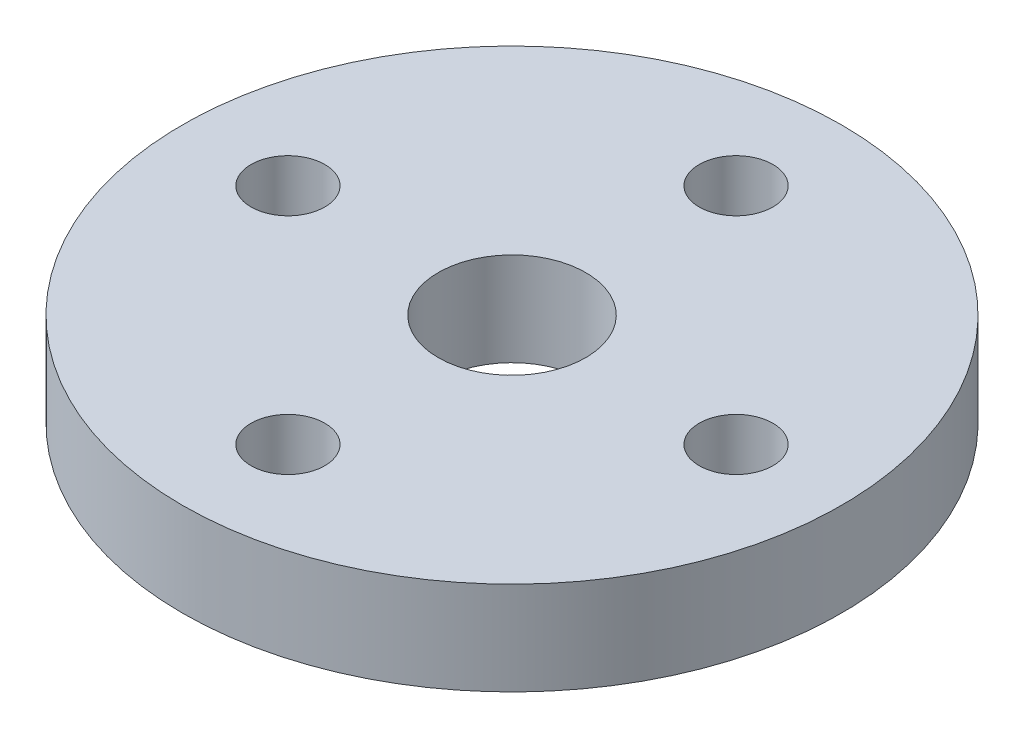
from build123d import *

# Parameters (mm, degrees)
SKETCH1_R           = 17.65
SKETCH1_R_2         = 3.95
SKETCH1_R_3         = 1.975
BOSS_EXTRUDE1_DEPTH = 5


with BuildPart() as part:
    # Sketch1 → Boss-Extrude1 (new body)
    with BuildSketch(Plane(origin=(0, 0, 0), x_dir=(1, 0, 0), z_dir=(0, 1, 0))):
        with Locations(Location((0, 0, 0), (0, 0, 270))):
            Circle(SKETCH1_R)
        with Locations(Location((0, 0, 0), (0, 0, 270))):
            Circle(SKETCH1_R_2, mode=Mode.SUBTRACT)
        with Locations(Location((0, 12, 0), (0, 0, 270))):
            Circle(SKETCH1_R_3, mode=Mode.SUBTRACT)
        with Locations(Location((-12, 0, 0), (0, 0, 270))):
            Circle(SKETCH1_R_3, mode=Mode.SUBTRACT)
        with Locations(Location((12, 0, 0), (0, 0, 90))):
            Circle(SKETCH1_R_3, mode=Mode.SUBTRACT)
        with Locations(Location((0, -12, 0), (0, 0, 90))):
            Circle(SKETCH1_R_3, mode=Mode.SUBTRACT)
    extrude(amount=BOSS_EXTRUDE1_DEPTH)


solid = part.part
